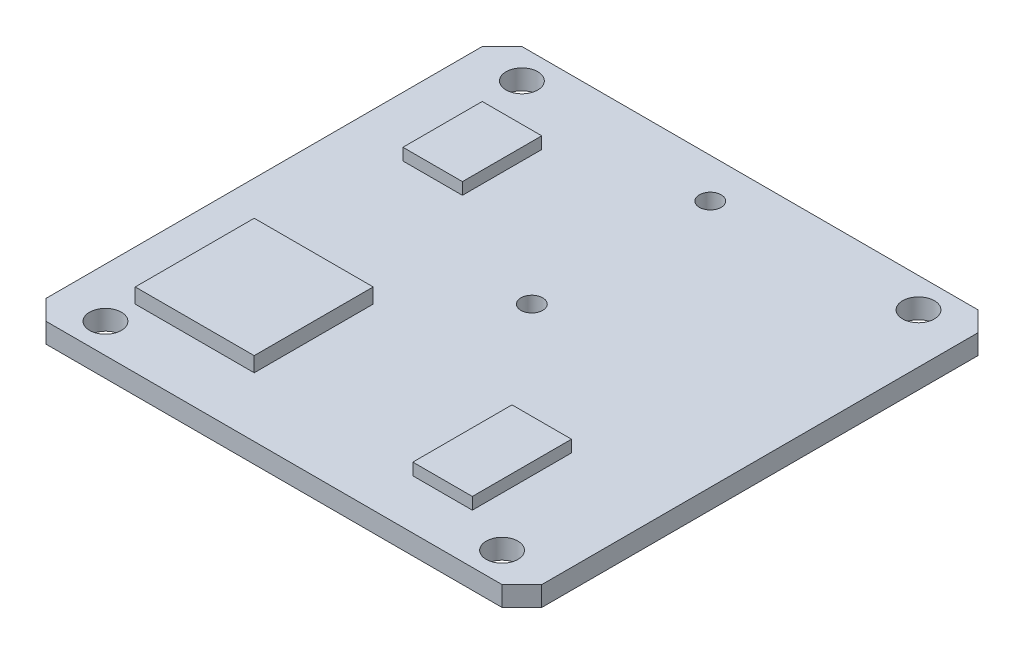
from build123d import *

# Parameters (mm, degrees)
SKETCH2_W           = 50
SKETCH2_H           = 48
BOSS_EXTRUDE1_DEPTH = 1
CHAMFER1_SIZE       = 2
SKETCH3_R           = 1.6
SKETCH3_R_2         = 1.1
CUT_EXTRUDE1_DEPTH  = 35.713109915
SKETCH5_W           = 12
SKETCH5_H           = 12
BOSS_EXTRUDE2_DEPTH = 1.5
SKETCH6_W           = 6
SKETCH6_H           = 8
SKETCH6_H_2         = 10
BOSS_EXTRUDE3_DEPTH = 1.2


with BuildPart() as part:
    # Sketch2 → Boss-Extrude1 (new, symmetric)
    with BuildSketch(Plane(origin=(0, 0, 0), x_dir=(1, 0, 0), z_dir=(0, 1, 0))):
        Rectangle(SKETCH2_W, SKETCH2_H)
    extrude(amount=BOSS_EXTRUDE1_DEPTH, both=True)

    # Chamfer1
    chamfer1_edges = [part.edges().sort_by_distance(p)[0] for p in [
        (-25, 0, -24),
        (25, 0, -24),
        (25, 0, 24),
        (-25, 0, 24),
    ]]
    chamfer(chamfer1_edges, length=CHAMFER1_SIZE)

    # Sketch3 → Cut-Extrude1 (cut, through all)
    with BuildSketch(Plane(origin=(0, 1, 0), x_dir=(1, 0, 0), z_dir=(0, 1, 0))):
        with Locations(Location((-20, 21, 0), (0, 0, 270))):
            Circle(SKETCH3_R)
        with Locations(Location((20, 21, 0), (0, 0, 90))):
            Circle(SKETCH3_R)
        with Locations(Location((20, -21, 0), (0, 0, 270))):
            Circle(SKETCH3_R)
        with Locations(Location((-20, -21, 0), (0, 0, 90))):
            Circle(SKETCH3_R)
        with Locations(Location((0, 20, 0), (0, 0, 270))):
            Circle(SKETCH3_R_2)
        with Locations(Location((0, 2, 0), (0, 0, 270))):
            Circle(SKETCH3_R_2)
    extrude(amount=-CUT_EXTRUDE1_DEPTH, mode=Mode.SUBTRACT)

    # Sketch5 → Boss-Extrude2 (add)
    with BuildSketch(Plane(origin=(0, 1, 0), x_dir=(1, 0, 0), z_dir=(0, 1, 0))):
        with Locations((-14, -12)):
            Rectangle(SKETCH5_W, SKETCH5_H)
    extrude(amount=BOSS_EXTRUDE2_DEPTH)

    # Sketch6 → Boss-Extrude3 (add)
    with BuildSketch(Plane(origin=(0, 1, 0), x_dir=(1, 0, 0), z_dir=(0, 1, 0))):
        with Locations((-16, 12)):
            Rectangle(SKETCH6_W, SKETCH6_H)
        with Locations((12, -14)):
            Rectangle(SKETCH6_W, SKETCH6_H_2)
    extrude(amount=BOSS_EXTRUDE3_DEPTH)


solid = part.part
